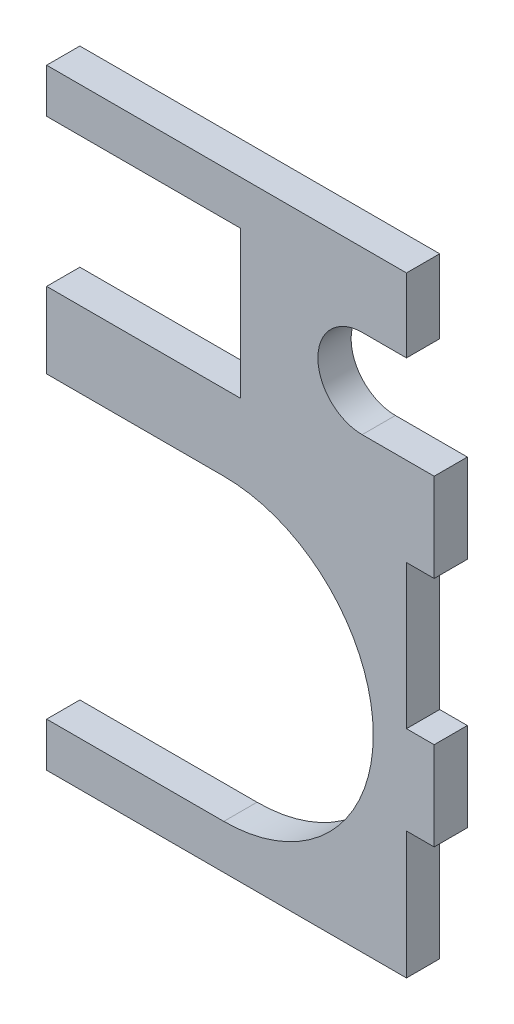
from build123d import *

# Parameters (mm, degrees)
BOSS_EXTRU_1_DEPTH = 3


with BuildPart() as part:
    # Esquisse1 → Boss.-Extru.1 (new body)
    with BuildSketch(Plane.XY):
        with BuildLine():
            Line((-16, 33.65), (-16, 37.65))
            Line((-16, 37.65), (16.5, 37.65))
            Line((16.5, 37.65), (16.5, 31))
            Line((16.5, 31), (12.5, 31))
            ThreePointArc((12.5, 31), (8.5, 27), (12.5, 23))
            Line((12.5, 23), (19, 23))
            Line((19, 23), (19, 15))
            Line((19, 15), (16.5, 15))
            Line((16.5, 15), (16.5, 2))
            Line((16.5, 2), (19, 2))
            Line((19, 2), (19, -6))
            Line((19, -6), (16.5, -6))
            Line((16.5, -6), (16.5, -17.5))
            Line((16.5, -17.5), (-16, -17.5))
            Line((-16, -17.5), (-16, -13.5))
            Line((-16, -13.5), (0, -13.5))
            ThreePointArc((0, -13.5), (13.5, 0), (0, 13.5))
            Line((0, 13.5), (-16, 13.5))
            Line((-16, 13.5), (-16, 20.35))
            Line((-16, 20.35), (1.5, 20.35))
            Line((1.5, 20.35), (1.5, 33.65))
            Line((1.5, 33.65), (-16, 33.65))
        make_face()
    extrude(amount=BOSS_EXTRU_1_DEPTH)


solid = part.part
